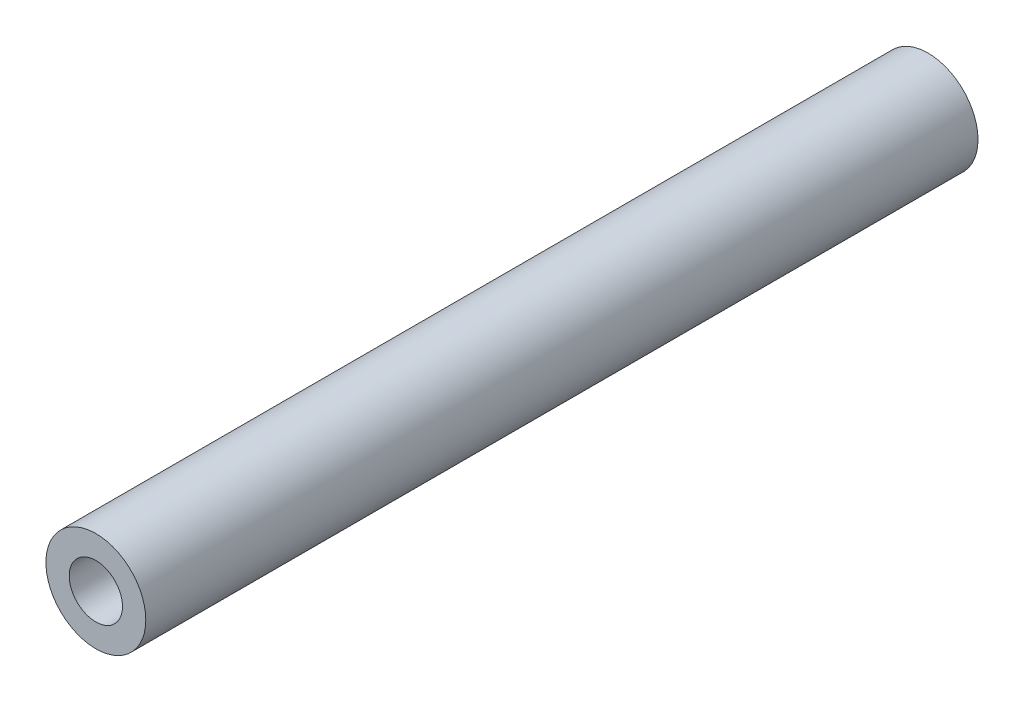
from build123d import *

# Parameters (mm, degrees)
SKETCH_1_R   = 3
SKETCH_1_R_2 = 1.6
F_40MM_DEPTH = 50


with BuildPart() as part:
    # 草图1 → 40mm铝柱 (new body)
    with BuildSketch(Plane.XY):
        Circle(SKETCH_1_R)
        Circle(SKETCH_1_R_2, mode=Mode.SUBTRACT)
    extrude(amount=F_40MM_DEPTH)


solid = part.part
